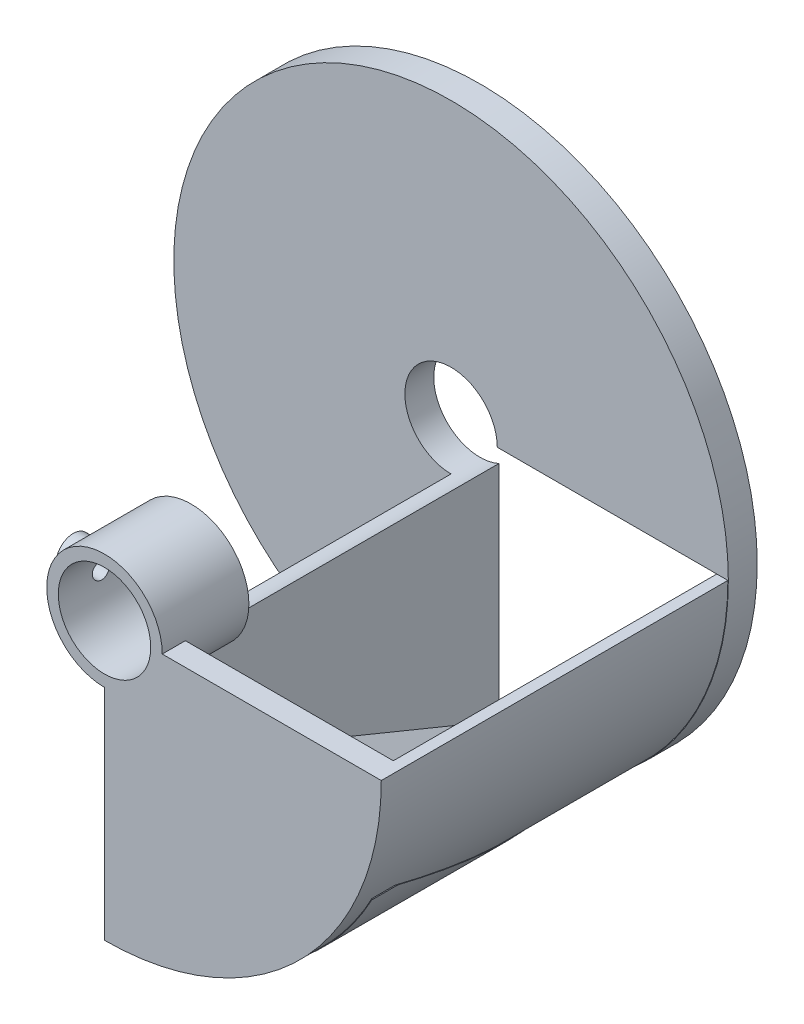
from build123d import *

# Parameters (mm, degrees)
SKETCH1_R            = 48
SKETCH1_R_2          = 8
BOSS_EXTRUDE1_DEPTH  = 5
BOSS_EXTRUDE2_DEPTH  = 60
CUT_EXTRUDE1_DEPTH   = 61
BOSS_EXTRUDE5_START  = -15
SKETCH8_R            = 10
SKETCH8_R_2          = 8
BOSS_EXTRUDE5_DEPTH  = 15
BOSS_EXTRUDE10_DEPTH = 39
SKETCH10_R           = 64.589244017
SKETCH10_R_2         = 48
CUT_EXTRUDE2_DEPTH   = 100
SKETCH11_R           = 1.5
CUT_EXTRUDE5_DEPTH   = 16
SKETCH12_R           = 3
SKETCH12_R_2         = 1.5
BOSS_EXTRUDE12_DEPTH = 3


with BuildPart() as part:
    # Sketch1 → Boss-Extrude1 (new body)
    with BuildSketch(Plane.XY):
        Circle(SKETCH1_R)
        Circle(SKETCH1_R_2, mode=Mode.SUBTRACT)
    extrude(amount=BOSS_EXTRUDE1_DEPTH)

    # Sketch2 → Boss-Extrude2 (add)
    with BuildSketch(Plane.XY.offset(5)):
        with BuildLine():
            Line((0, -8), (0, -47.918307097))
            ThreePointArc((0, -47.918307097), (33.883359891, -33.883359891), (47.918307097, 0))
            Line((47.918307097, 0), (8, 0))
            ThreePointArc((8, 0), (5.656854249, -5.656854249), (0, -8))
        make_face()
    extrude(amount=BOSS_EXTRUDE2_DEPTH)

    # Sketch3 → Cut-Extrude1 (cut)
    with BuildSketch(Plane(origin=(0, 0, 0), x_dir=(-1, 0, 0), z_dir=(0, 0, -1))):
        with BuildLine():
            Line((-3.276389164, -45.883169834), (-3.276389164, -8))
            Line((-3.276389164, -8), (-3.276389164, -7.298306245))
            ThreePointArc((-3.276389164, -7.298306245), (-6.716067053, -4.346773901), (-8, 0))
            Line((-8, 0), (-46, 0))
            ThreePointArc((-46, 0), (-33.665367231, -31.347137816), (-3.276389164, -45.883169834))
        make_face()
    extrude(amount=-CUT_EXTRUDE1_DEPTH, mode=Mode.SUBTRACT)

    # Sketch8 → Boss-Extrude5 (add)
    with BuildSketch(Plane.XY.offset(65).offset(BOSS_EXTRUDE5_START)):
        Circle(SKETCH8_R)
        Circle(SKETCH8_R_2, mode=Mode.SUBTRACT)
    extrude(amount=BOSS_EXTRUDE5_DEPTH)

    # Sketch11 → Cut-Extrude5 (cut)
    with BuildSketch(Plane(origin=(0, 0, 0), x_dir=(0, 0, -1), z_dir=(1, 0, 0))):
        with Locations((-57.616287705, 0)):
            Circle(SKETCH11_R)
    extrude(amount=-CUT_EXTRUDE5_DEPTH, mode=Mode.SUBTRACT)

    # Sketch12 → Boss-Extrude12 (add)
    with BuildSketch(Plane(origin=(-9.790957965, 0, 0), x_dir=(0, 0, -1), z_dir=(1, 0, 0))):
        with Locations((-57.616287705, 0)):
            Circle(SKETCH12_R)
        with Locations((-57.616287705, 0)):
            Circle(SKETCH12_R_2, mode=Mode.SUBTRACT)
    extrude(amount=-BOSS_EXTRUDE12_DEPTH)


with BuildPart() as body_2:
    # Sketch9 → Boss-Extrude10 (new body)
    with BuildSketch(Plane(origin=(3.276389164, 0, 0), x_dir=(0, 0, -1), z_dir=(1, 0, 0))):
        Polygon((-61, -45.883169834), (0, -45.883169834), (-61, -20.883169834), align=None)
    extrude(amount=BOSS_EXTRUDE10_DEPTH)

    # Sketch10 → Cut-Extrude2 (cut)
    with BuildSketch(Plane(origin=(0, 0, 0), x_dir=(-1, 0, 0), z_dir=(0, 0, -1))):
        Circle(SKETCH10_R)
        with Locations(Location((0, 0, 0), (0, 0, 180))):
            Circle(SKETCH10_R_2, mode=Mode.SUBTRACT)
    extrude(amount=-CUT_EXTRUDE2_DEPTH, mode=Mode.SUBTRACT)


solid = Compound([part.part, body_2.part])
